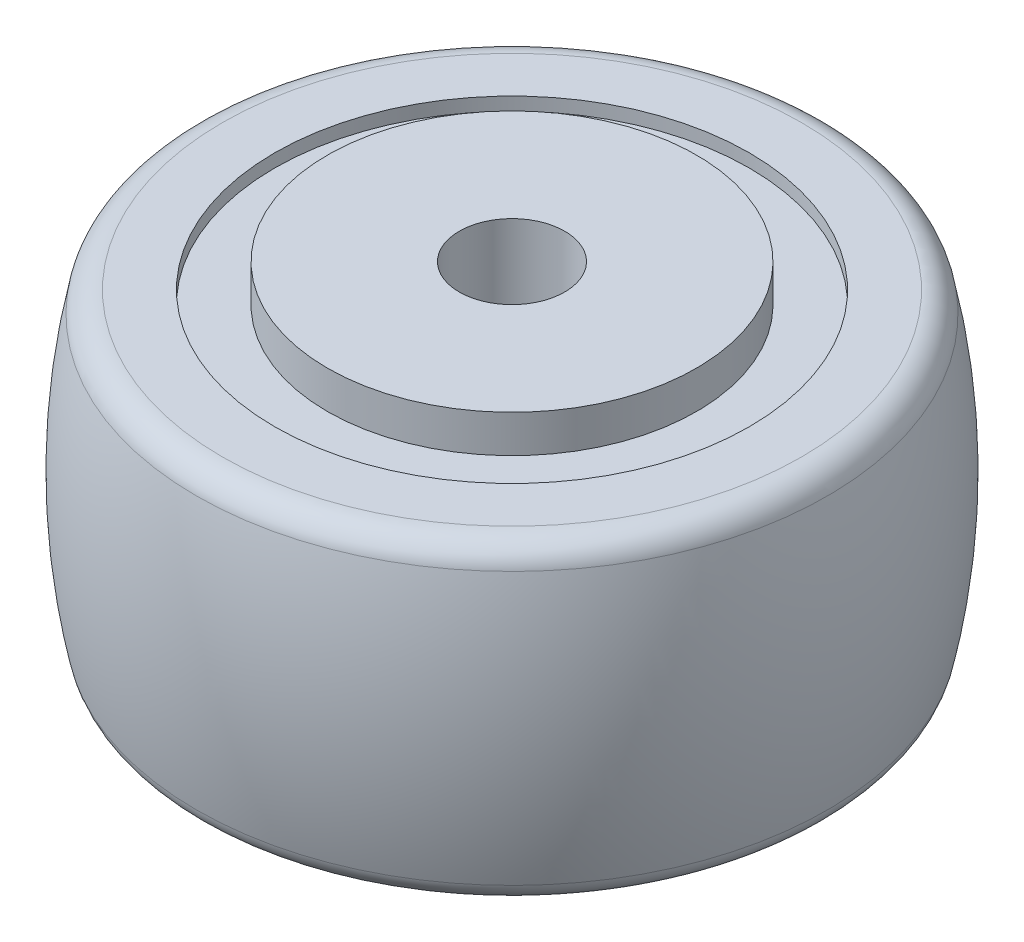
from build123d import *


with BuildPart() as part:
    # 草图1 → 旋转1 (revolve)
    with BuildSketch(Plane(origin=(0, 0, 0), x_dir=(-1, 0, 0), z_dir=(0, 0, -1)), mode=Mode.PRIVATE) as revolve_1_sk:
        with BuildLine():
            Line((-14, -13.75), (-4, -13.75))
            Line((-4, -13.75), (-4, 13.75))
            Line((-4, 13.75), (-14, 13.75))
            Line((-14, 13.75), (-14, 10.9))
            Line((-14, 10.9), (-18, 10.9))
            Line((-18, 10.9), (-18, 11.9))
            Line((-18, 11.9), (-21.967967808, 11.9))
            ThreePointArc((-21.967967808, 11.9), (-23.227928125, 11.453222457), (-23.924966467, 10.3125))
            ThreePointArc((-23.924966467, 10.3125), (-25, 0), (-23.924966467, -10.3125))
            ThreePointArc((-23.924966467, -10.3125), (-23.227928125, -11.453222457), (-21.967967808, -11.9))
            Line((-21.967967808, -11.9), (-18, -11.9))
            Line((-18, -11.9), (-18, -10.9))
            Line((-18, -10.9), (-14, -10.9))
            Line((-14, -10.9), (-14, -13.75))
        make_face()
    revolve(revolve_1_sk.sketch.rotate(Axis((0, -13.75, 0), (0, 1, 0)), 270), axis=Axis((0, -13.75, 0), (0, 1, 0)))


solid = part.part
